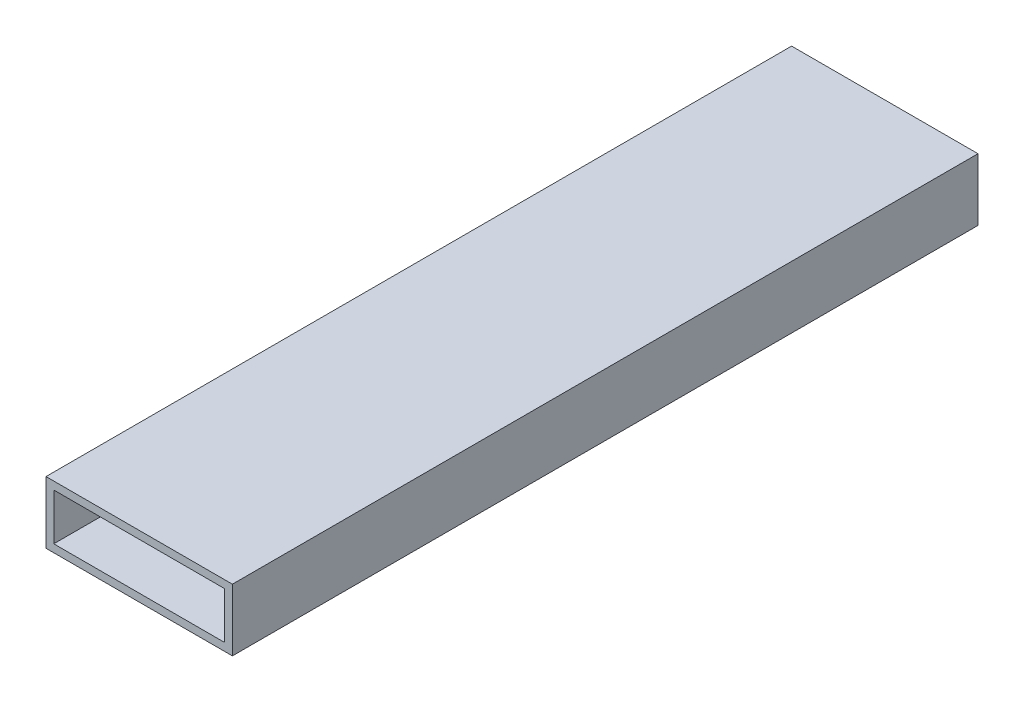
from build123d import *

# Parameters (mm, degrees)
SKETCH1_W      = 76.2
SKETCH1_H      = 25.4
EXTRUDE1_DEPTH = 152.4
SKETCH2_W      = 69.85
SKETCH2_H      = 19.05
EXTRUDE2_DEPTH = 308.434448298


with BuildPart() as part:
    # Sketch1 → Extrude1 (new, symmetric)
    with BuildSketch(Plane.XY):
        Rectangle(SKETCH1_W, SKETCH1_H)
    extrude(amount=EXTRUDE1_DEPTH, both=True)

    # Sketch2 → Extrude2 (cut, through all)
    with BuildSketch(Plane.XY.offset(152.4)):
        Rectangle(SKETCH2_W, SKETCH2_H)
    extrude(amount=-EXTRUDE2_DEPTH, mode=Mode.SUBTRACT)


solid = part.part
